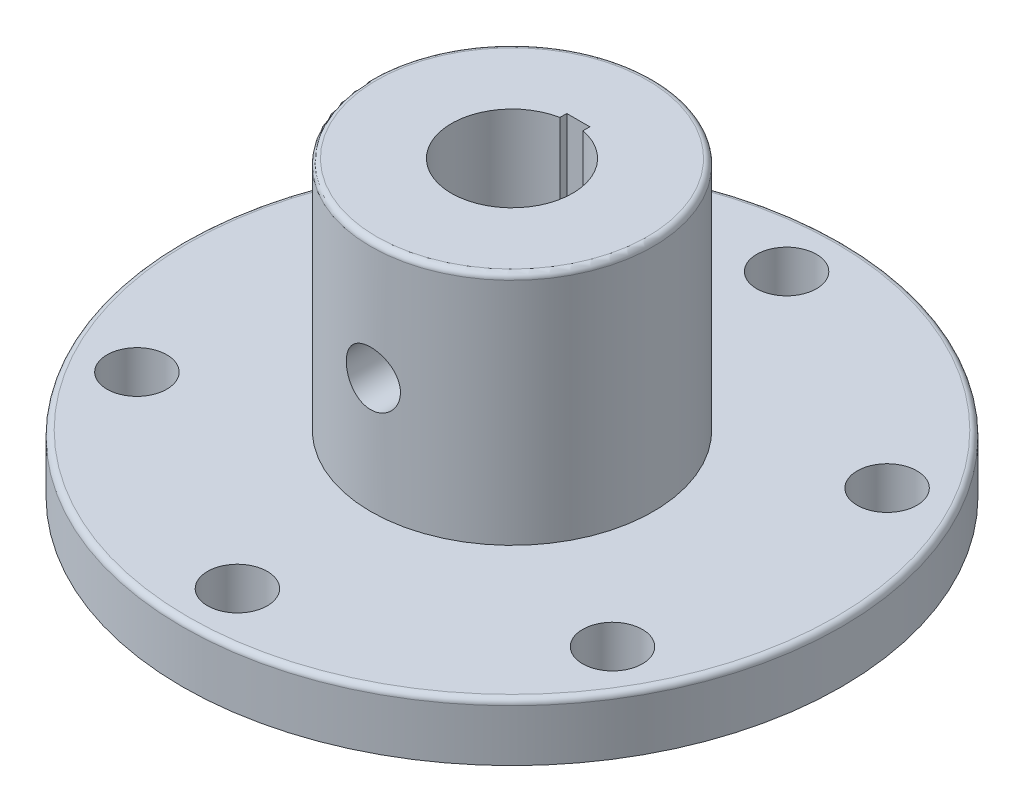
from build123d import *

# Parameters (mm, degrees)
SKETCH1_R           = 28.575
SKETCH1_R_2         = 2.5908
SKETCH1_R_3         = 12.25
BOSS_EXTRUDE1_DEPTH = 5
SKETCH1_3_R         = 12.25
SKETCH1_3_R_2       = 5.25
BOSS_EXTRUDE2_DEPTH = 25.4
FILLET2_R           = 0.5
SKETCH2_W           = 2
SKETCH2_H           = 1
CUT_EXTRUDE1_DEPTH  = 48.730716061
SKETCH3_R           = 2.3495
CUT_EXTRUDE4_DEPTH  = 25.4


with BuildPart() as part:
    # Sketch1 → Boss-Extrude1 (new body)
    with BuildSketch(Plane(origin=(0, 0, 0), x_dir=(1, 0, 0), z_dir=(0, 1, 0))):
        Circle(SKETCH1_R)
        with Locations((-20.622229928, -11.90625)):
            Circle(SKETCH1_R_2, mode=Mode.SUBTRACT)
        with Locations((0, -23.8125)):
            Circle(SKETCH1_R_2, mode=Mode.SUBTRACT)
        with Locations((20.622229928, -11.90625)):
            Circle(SKETCH1_R_2, mode=Mode.SUBTRACT)
        with Locations((-20.622229928, 11.90625)):
            Circle(SKETCH1_R_2, mode=Mode.SUBTRACT)
        Circle(SKETCH1_R_3, mode=Mode.SUBTRACT)
        with Locations((20.622229928, 11.90625)):
            Circle(SKETCH1_R_2, mode=Mode.SUBTRACT)
        with Locations((0, 23.8125)):
            Circle(SKETCH1_R_2, mode=Mode.SUBTRACT)
    extrude(amount=BOSS_EXTRUDE1_DEPTH)

    # Sketch1<3> → Boss-Extrude2 (add)
    with BuildSketch(Plane(origin=(0, 0, 0), x_dir=(1, 0, 0), z_dir=(0, 1, 0))):
        Circle(SKETCH1_3_R)
        Circle(SKETCH1_3_R_2, mode=Mode.SUBTRACT)
    extrude(amount=BOSS_EXTRUDE2_DEPTH)

    # Fillet2
    fillet2_edges = [part.edges().sort_by_distance(p)[0] for p in [
        (-12.25, 25.4, 0),
        (-28.575, 5, 0),
    ]]
    fillet(fillet2_edges, radius=FILLET2_R)

    # Sketch2 → Cut-Extrude1 (cut, through all)
    with BuildSketch(Plane(origin=(0, 25.4, 0), x_dir=(1, 0, 0), z_dir=(0, 1, 0))):
        with Locations((0, 5.25)):
            Rectangle(SKETCH2_W, SKETCH2_H)
    extrude(amount=-CUT_EXTRUDE1_DEPTH, mode=Mode.SUBTRACT)

    # Sketch3 → Cut-Extrude4 (cut)
    with BuildSketch(Plane.XY.offset(-5.75)):
        with Locations((0, 15)):
            Circle(SKETCH3_R)
    extrude(amount=CUT_EXTRUDE4_DEPTH, mode=Mode.SUBTRACT)


solid = part.part
